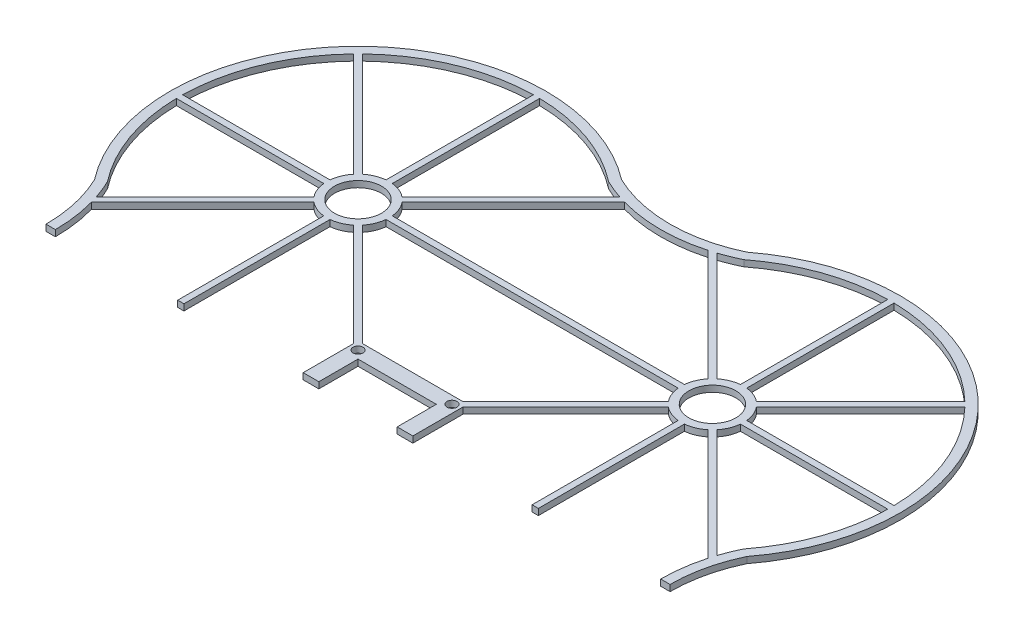
from build123d import *

# Parameters (mm, degrees)
BOSS_EXTRUDE1_DEPTH = 2
BOSS_EXTRUDE3_START = -2
SKETCH2_R           = 7.5
SKETCH2_R_2         = 7.500000001
SKETCH2_W           = 25
SKETCH2_H           = 25
SKETCH2_R_3         = 7.499999999
BOSS_EXTRUDE3_DEPTH = 2
CUT_EXTRUDE1_DEPTH  = 140


with BuildPart() as part:
    # Sketch1 → Boss-Extrude1 (new body)
    with BuildSketch(Plane(origin=(0, 0, 0), x_dir=(1, 0, 0), z_dir=(0, 1, 0))):
        with BuildLine():
            ThreePointArc((-20, -104.136827095), (0, -99.604797561), (20, -104.136827095))
            ThreePointArc((20, -104.136827095), (98.994949366, -98.994949366), (104.136827095, -20))
            ThreePointArc((104.136827095, -20), (99.604797561, 0), (104.136827095, 20))
            ThreePointArc((104.136827095, 20), (98.994949366, 98.994949366), (20, 104.136827095))
            ThreePointArc((20, 104.136827095), (0, 99.604797561), (-20, 104.136827095))
            ThreePointArc((-20, 104.136827095), (-98.994949366, 98.994949366), (-104.136827095, 20))
            ThreePointArc((-104.136827095, 20), (-99.604797561, 0), (-104.136827095, -20))
            ThreePointArc((-104.136827095, -20), (-98.994949366, -98.994949366), (-20, -104.136827095))
        make_face()
        with BuildLine():
            ThreePointArc((21.585746938, 101.570809271), (0, 96.604797561), (-21.585746938, 101.570809271))
            ThreePointArc((-21.585746938, 101.570809271), (-96.873629023, 96.873629023), (-101.570809271, 21.585746938))
            ThreePointArc((-101.570809271, 21.585746938), (-96.604797561, 0), (-101.570809271, -21.585746938))
            ThreePointArc((-101.570809271, -21.585746938), (-96.873629023, -96.873629023), (-21.585746938, -101.570809271))
            ThreePointArc((-21.585746938, -101.570809271), (0, -96.604797561), (21.585746938, -101.570809271))
            ThreePointArc((21.585746938, -101.570809271), (96.873629023, -96.873629023), (101.570809271, -21.585746938))
            ThreePointArc((101.570809271, -21.585746938), (96.604797561, 0), (101.570809271, 21.585746938))
            ThreePointArc((101.570809271, 21.585746938), (96.873629023, 96.873629023), (21.585746938, 101.570809271))
        make_face(mode=Mode.SUBTRACT)
    extrude(amount=BOSS_EXTRUDE1_DEPTH)

    # Sketch2 → Boss-Extrude3 (add)
    with BuildSketch(Plane(origin=(0, 2, 0), x_dir=(1, 0, 0), z_dir=(0, 1, 0)).offset(BOSS_EXTRUDE3_START)):
        with BuildLine():
            ThreePointArc((-96.873629023, 96.873629023), (-97.225645195, 96.518511206), (-97.574532635, 96.160319073))
            Line((-97.574532635, 96.160319073), (-64.311272916, 62.897059353))
            ThreePointArc((-64.311272916, 62.897059353), (-65.80733782, 60.395376819), (-66.518416866, 57.568542495))
            Line((-66.518416866, 57.568542495), (-113.55976989, 57.568542495))
            ThreePointArc((-113.55976989, 57.568542495), (-113.568542495, 56.568542495), (-113.55976989, 55.568542495))
            Line((-113.55976989, 55.568542495), (-66.518416866, 55.568542495))
            ThreePointArc((-66.518416866, 55.568542495), (-65.80733782, 52.741708171), (-64.311272916, 50.240025637))
            Line((-64.311272916, 50.240025637), (-99.087660161, 15.463638392))
            ThreePointArc((-99.087660161, 15.463638392), (-98.745220484, 14.383211249), (-98.427659658, 13.29521177))
            Line((-98.427659658, 13.29521177), (-62.897059354, 48.825812074))
            ThreePointArc((-62.897059354, 48.825812074), (-60.395376819, 47.32974717), (-57.568542495, 46.618668124))
            Line((-57.568542495, 46.618668124), (-57.568542495, 0.431457505))
            Line((-57.568542494, 0.431457505), (-57.568542494, -46.568542495))
            Line((-57.568542495, -46.568542495), (-57.568542495, -46.618668125))
            ThreePointArc((-57.568542495, -46.618668125), (-60.395376818, -47.329747171), (-62.897059353, -48.825812075))
            Line((-62.897059353, -48.825812075), (-98.427659658, -13.29521177))
            ThreePointArc((-98.427659658, -13.29521177), (-98.745220484, -14.383211249), (-99.087660161, -15.463638392))
            Line((-99.087660161, -15.463638392), (-64.311272915, -50.240025637))
            ThreePointArc((-64.311272915, -50.240025637), (-65.80733782, -52.741708172), (-66.518416866, -55.568542496))
            Line((-66.518416866, -55.568542496), (-113.55976989, -55.568542496))
            ThreePointArc((-113.55976989, -55.568542496), (-113.568542495, -56.568542496), (-113.55976989, -57.568542496))
            Line((-113.55976989, -57.568542496), (-66.518416866, -57.568542496))
            ThreePointArc((-66.518416866, -57.568542496), (-65.80733782, -60.395376819), (-64.311272916, -62.897059354))
            Line((-64.311272916, -62.897059354), (-97.574532635, -96.160319074))
            ThreePointArc((-97.574532635, -96.160319074), (-96.873629022, -96.873629023), (-96.160319072, -97.574532636))
            Line((-96.160319072, -97.574532636), (-62.897059353, -64.311272917))
            ThreePointArc((-62.897059353, -64.311272917), (-60.395376818, -65.807337821), (-57.568542495, -66.518416867))
            Line((-57.568542495, -66.518416867), (-57.568542495, -113.55976989))
            ThreePointArc((-57.568542495, -113.55976989), (-56.568542495, -113.568542495), (-55.568542495, -113.55976989))
            Line((-55.568542495, -113.55976989), (-55.568542495, -66.518416867))
            ThreePointArc((-55.568542495, -66.518416867), (-52.741708171, -65.807337821), (-50.240025636, -64.311272917))
            Line((-50.240025636, -64.311272917), (-15.463638392, -99.087660161))
            ThreePointArc((-15.463638392, -99.087660161), (-14.383211249, -98.745220484), (-13.295211771, -98.427659658))
            Line((-13.295211771, -98.427659658), (-48.825812074, -62.897059354))
            ThreePointArc((-48.825812074, -62.897059354), (-47.329747169, -60.395376819), (-46.618668124, -57.568542495))
            Line((-46.618668124, -57.568542495), (-46.568542618, -57.568542495))
            Line((-46.568542618, -57.568542496), (0.431457381, -57.568542496))
            Line((0.431457381, -57.568542495), (46.618668125, -57.568542495))
            ThreePointArc((46.618668125, -57.568542495), (47.329747171, -60.395376819), (48.825812075, -62.897059354))
            Line((48.825812075, -62.897059354), (13.295211771, -98.427659658))
            ThreePointArc((13.295211771, -98.427659658), (14.38321125, -98.745220484), (15.463638393, -99.087660161))
            Line((15.463638393, -99.087660161), (50.240025637, -64.311272916))
            ThreePointArc((50.240025637, -64.311272916), (52.741708172, -65.807337821), (55.568542496, -66.518416867))
            Line((55.568542496, -66.518416867), (55.568542496, -113.55976989))
            ThreePointArc((55.568542496, -113.55976989), (56.568542496, -113.568542495), (57.568542496, -113.55976989))
            Line((57.568542496, -113.55976989), (57.568542496, -66.518416867))
            ThreePointArc((57.568542496, -66.518416867), (60.39537682, -65.807337821), (62.897059355, -64.311272916))
            Line((62.897059355, -64.311272916), (96.160319073, -97.574532635))
            ThreePointArc((96.160319073, -97.574532635), (96.873629023, -96.873629022), (97.574532636, -96.160319073))
            Line((97.574532636, -96.160319073), (64.311272917, -62.897059354))
            ThreePointArc((64.311272917, -62.897059354), (65.807337821, -60.395376819), (66.518416867, -57.568542496))
            Line((66.518416867, -57.568542496), (113.55976989, -57.568542496))
            ThreePointArc((113.55976989, -57.568542496), (113.568542495, -56.568542496), (113.55976989, -55.568542496))
            Line((113.55976989, -55.568542496), (66.518416867, -55.568542496))
            ThreePointArc((66.518416867, -55.568542496), (65.807337821, -52.741708172), (64.311272917, -50.240025637))
            Line((64.311272917, -50.240025637), (99.087660161, -15.463638393))
            ThreePointArc((99.087660161, -15.463638393), (98.745220484, -14.38321125), (98.427659658, -13.295211771))
            Line((98.427659658, -13.295211771), (62.897059355, -48.825812075))
            ThreePointArc((62.897059355, -48.825812075), (60.39537682, -47.32974717), (57.568542495, -46.618668124))
            Line((57.568542495, -46.618668124), (57.568542495, -46.568542603))
            Line((57.568542496, -46.568542603), (57.568542496, 0.431457382))
            Line((57.568542495, 0.431457382), (57.568542495, 46.618668124))
            ThreePointArc((57.568542495, 46.618668124), (60.395376819, 47.32974717), (62.897059354, 48.825812074))
            Line((62.897059354, 48.825812074), (98.427659658, 13.295211771))
            ThreePointArc((98.427659658, 13.295211771), (98.745220484, 14.383211249), (99.087660161, 15.463638392))
            Line((99.087660161, 15.463638392), (64.311272917, 50.240025636))
            ThreePointArc((64.311272917, 50.240025636), (65.807337821, 52.741708171), (66.518416867, 55.568542495))
            Line((66.518416867, 55.568542495), (113.55976989, 55.568542495))
            ThreePointArc((113.55976989, 55.568542495), (113.568542495, 56.568542495), (113.55976989, 57.568542495))
            Line((113.55976989, 57.568542495), (66.518416867, 57.568542495))
            ThreePointArc((66.518416867, 57.568542495), (65.807337821, 60.395376819), (64.311272917, 62.897059354))
            Line((64.311272917, 62.897059354), (97.574532636, 96.160319073))
            ThreePointArc((97.574532636, 96.160319073), (96.873629023, 96.873629022), (96.160319073, 97.574532635))
            Line((96.160319073, 97.574532635), (62.897059354, 64.311272916))
            ThreePointArc((62.897059354, 64.311272916), (60.395376819, 65.80733782), (57.568542496, 66.518416866))
            Line((57.568542496, 66.518416866), (57.568542496, 113.55976989))
            ThreePointArc((57.568542496, 113.55976989), (56.568542496, 113.568542495), (55.568542496, 113.55976989))
            Line((55.568542496, 113.55976989), (55.568542496, 66.518416866))
            ThreePointArc((55.568542496, 66.518416866), (52.741708172, 65.80733782), (50.240025637, 64.311272916))
            Line((50.240025637, 64.311272916), (15.463638393, 99.087660161))
            ThreePointArc((15.463638393, 99.087660161), (14.38321125, 98.745220484), (13.295211771, 98.427659658))
            Line((13.295211771, 98.427659658), (48.825812075, 62.897059354))
            ThreePointArc((48.825812075, 62.897059354), (47.329747171, 60.395376819), (46.618668125, 57.568542496))
            Line((46.618668125, 57.568542496), (0.431457505, 57.568542496))
            Line((0.431457505, 57.568542495), (-46.568542493, 57.568542495))
            Line((-46.568542493, 57.568542495), (-46.618668124, 57.568542495))
            ThreePointArc((-46.618668124, 57.568542495), (-47.32974717, 60.395376818), (-48.825812074, 62.897059353))
            Line((-48.825812074, 62.897059353), (-13.29521177, 98.427659657))
            ThreePointArc((-13.29521177, 98.427659657), (-14.383211248, 98.745220484), (-15.463638391, 99.087660161))
            Line((-15.463638391, 99.087660161), (-50.240025636, 64.311272916))
            ThreePointArc((-50.240025636, 64.311272916), (-52.741708171, 65.80733782), (-55.568542495, 66.518416866))
            Line((-55.568542495, 66.518416866), (-55.568542495, 113.55976989))
            ThreePointArc((-55.568542495, 113.55976989), (-56.568542495, 113.568542495), (-57.568542495, 113.55976989))
            Line((-57.568542495, 113.55976989), (-57.568542495, 66.518416866))
            ThreePointArc((-57.568542495, 66.518416866), (-60.395376819, 65.80733782), (-62.897059353, 64.311272916))
            Line((-62.897059353, 64.311272916), (-96.160319073, 97.574532635))
            ThreePointArc((-96.160319073, 97.574532635), (-96.518511206, 97.225645195), (-96.873629023, 96.873629023))
        make_face()
        with Locations(Location((-56.568542495, -56.568542496, 0), (0, 0, 270))):
            Circle(SKETCH2_R, mode=Mode.SUBTRACT)
        with BuildLine():
            Line((-17.5, 16.085786437), (-17.5, -16.085786439))
            Line((-17.5, -16.085786439), (-50.240025636, -48.825812075))
            ThreePointArc((-50.240025636, -48.825812075), (-52.741708171, -47.329747171), (-55.568542495, -46.618668125))
            Line((-55.568542495, -46.618668125), (-55.568542495, -46.568542494))
            Line((-55.568542494, -46.568542494), (-55.568542494, 0.431457505))
            Line((-55.568542495, 0.431457505), (-55.568542495, 46.618668124))
            ThreePointArc((-55.568542495, 46.618668124), (-52.741708172, 47.32974717), (-50.240025637, 48.825812074))
            Line((-50.240025637, 48.825812074), (-17.5, 16.085786437))
        make_face(mode=Mode.SUBTRACT)
        with BuildLine():
            ThreePointArc((-15, -13.4), (-13.86862915, -13.86862915), (-13.4, -15))
            ThreePointArc((-13.4, -15), (-16.13137085, -16.13137085), (-15, -13.4))
        make_face(mode=Mode.SUBTRACT)
        with BuildLine():
            Line((-16.085786436, -17.5), (16.085786439, -17.5))
            Line((16.085786439, -17.5), (48.825812075, -50.240025637))
            ThreePointArc((48.825812075, -50.240025637), (47.329747171, -52.741708172), (46.618668125, -55.568542495))
            Line((46.618668125, -55.568542495), (0.431457395, -55.568542495))
            Line((0.431457395, -55.568542496), (-46.568542604, -55.568542496))
            Line((-46.568542604, -55.568542495), (-46.618668124, -55.568542495))
            ThreePointArc((-46.618668124, -55.568542495), (-47.32974717, -52.741708172), (-48.825812073, -50.240025638))
            Line((-48.825812073, -50.240025638), (-16.085786436, -17.5))
        make_face(mode=Mode.SUBTRACT)
        with Locations(Location((56.568542496, -56.568542497, 0), (0, 0, 270))):
            Circle(SKETCH2_R_2, mode=Mode.SUBTRACT)
        with BuildLine():
            ThreePointArc((16.6, -15), (15, -16.6), (13.4, -15))
            ThreePointArc((13.4, -15), (13.86862915, -13.86862915), (15, -13.4))
            ThreePointArc((15, -13.4), (16.13137085, -13.86862915), (16.6, -15))
        make_face(mode=Mode.SUBTRACT)
        Rectangle(SKETCH2_W, SKETCH2_H, mode=Mode.SUBTRACT)
        with BuildLine():
            ThreePointArc((-15, 13.4), (-16.13137085, 16.13137085), (-13.4, 15))
            ThreePointArc((-13.4, 15), (-13.86862915, 13.86862915), (-15, 13.4))
        make_face(mode=Mode.SUBTRACT)
        with Locations(Location((-56.568542494, 56.568542495, 0), (0, 0, 270))):
            Circle(SKETCH2_R_3, mode=Mode.SUBTRACT)
        with BuildLine():
            ThreePointArc((16.6, 15), (16.13137085, 13.86862915), (15, 13.4))
            ThreePointArc((15, 13.4), (13.86862915, 13.86862915), (13.4, 15))
            ThreePointArc((13.4, 15), (15, 16.6), (16.6, 15))
        make_face(mode=Mode.SUBTRACT)
        with BuildLine():
            Line((50.240025638, -48.825812074), (17.5, -16.085786437))
            Line((17.5, -16.085786437), (17.5, 16.085786438))
            Line((17.5, 16.085786438), (50.240025637, 48.825812075))
            ThreePointArc((50.240025637, 48.825812075), (52.741708172, 47.32974717), (55.568542495, 46.618668124))
            Line((55.568542495, 46.618668124), (55.568542495, 0.431457395))
            Line((55.568542496, 0.431457395), (55.568542496, -46.56854259))
            Line((55.568542495, -46.56854259), (55.568542495, -46.618668124))
            ThreePointArc((55.568542495, -46.618668124), (52.741708172, -47.32974717), (50.240025638, -48.825812074))
        make_face(mode=Mode.SUBTRACT)
        with BuildLine():
            Line((48.825812075, 50.240025637), (16.085786438, 17.5))
            Line((16.085786438, 17.5), (-16.085786438, 17.5))
            Line((-16.085786438, 17.5), (-48.825812074, 50.240025636))
            ThreePointArc((-48.825812074, 50.240025636), (-47.32974717, 52.741708171), (-46.618668124, 55.568542495))
            Line((-46.618668124, 55.568542495), (-46.568542493, 55.568542495))
            Line((-46.568542493, 55.568542495), (0.431457505, 55.568542495))
            Line((0.431457505, 55.568542496), (46.618668125, 55.568542496))
            ThreePointArc((46.618668125, 55.568542496), (47.329747171, 52.741708172), (48.825812075, 50.240025637))
        make_face(mode=Mode.SUBTRACT)
        with Locations(Location((56.568542496, 56.568542494, 0), (0, 0, 270))):
            Circle(SKETCH2_R_2, mode=Mode.SUBTRACT)
    extrude(amount=BOSS_EXTRUDE3_DEPTH)

    # Sketch3 → Cut-Extrude1 (cut, symmetric)
    with BuildSketch(Plane(origin=(0, 2, 0), x_dir=(1, 0, 0), z_dir=(0, 1, 0))):
        Polygon((0, 0), (161.210858438, 0), (161.210858438, -128.045511529), (-148.172849587, -128.045511529), (-148.172849587, -116.600102678), (-171.421336318, 0), align=None)
    extrude(amount=CUT_EXTRUDE1_DEPTH, both=True, mode=Mode.SUBTRACT)


solid = part.part
